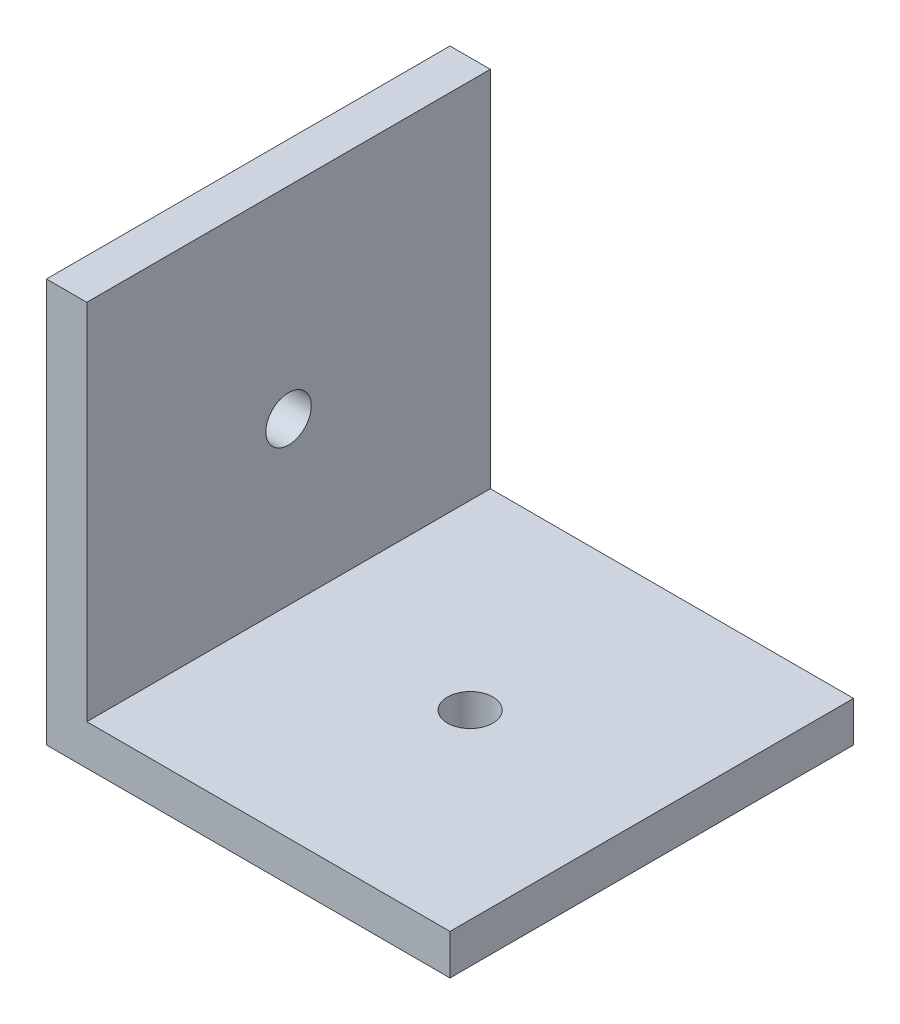
from build123d import *

# Parameters (mm, degrees)
BOSS_EXTRU_1_DEPTH = 40
D_GAGEMENT_M41_D   = 4.5
D_GAGEMENT_M42_D   = 4.5


with BuildPart() as part:
    # Esquisse1 → Boss.-Extru.1 (new body)
    with BuildSketch(Plane.XY):
        Polygon((0, 36), (0, 0), (36, 0), (36, -4), (-4, -4), (-4, 36), align=None)
    extrude(amount=BOSS_EXTRU_1_DEPTH)

    # Dégagement M41 (through all)
    with Locations(Plane(origin=(0, 0, 0), x_dir=(1, 0, 0), z_dir=(0, 1, 0))):
        with Locations((18, -20)):
            Hole(D_GAGEMENT_M41_D / 2)

    # Dégagement M42 (through all)
    with Locations(Plane(origin=(0, 0, 0), x_dir=(0, 0, -1), z_dir=(1, 0, 0))):
        with Locations((-20, 16)):
            Hole(D_GAGEMENT_M42_D / 2)


solid = part.part
